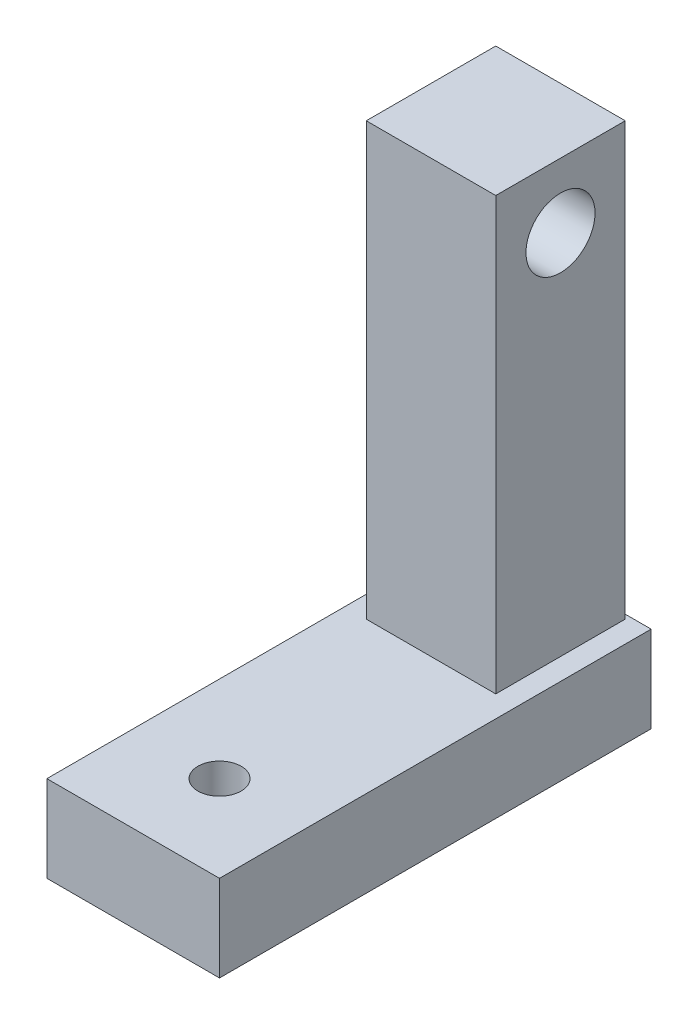
from build123d import *

# Parameters (mm, degrees)
ESQUISSE1_W             = 20
ESQUISSE1_H             = 50
ESQUISSE1_R             = 2.5
BOSS_EXTRU_1_DEPTH      = 10
ESQUISSE2_W             = 15
ESQUISSE2_H             = 15
BOSS_EXTRU_2_DEPTH      = 50
ESQUISSE3_R             = 4
ENL_V_MAT_EXTRU_1_DEPTH = 68.314560089


with BuildPart() as part:
    # Esquisse1 → Boss.-Extru.1 (new body)
    with BuildSketch(Plane(origin=(0, 0, 0), x_dir=(1, 0, 0), z_dir=(0, 1, 0))):
        Rectangle(ESQUISSE1_W, ESQUISSE1_H)
        with Locations(Location((0, -15, 0), (0, 0, 270))):
            Circle(ESQUISSE1_R, mode=Mode.SUBTRACT)
        with Locations(Location((0, 15, 0), (0, 0, 270))):
            Circle(ESQUISSE1_R, mode=Mode.SUBTRACT)
    extrude(amount=BOSS_EXTRU_1_DEPTH)


with BuildPart() as body_2:
    # Esquisse2 → Boss.-Extru.2 (new body)
    with BuildSketch(Plane(origin=(0, 10, 0), x_dir=(1, 0, 0), z_dir=(0, 1, 0))):
        with Locations((0, 17)):
            Rectangle(ESQUISSE2_W, ESQUISSE2_H)
    extrude(amount=BOSS_EXTRU_2_DEPTH)

    # Esquisse3 → Enlèv. mat.-Extru.1 (cut, through all)
    with BuildSketch(Plane(origin=(7.5, 0, 0), x_dir=(0, 0, -1), z_dir=(1, 0, 0))):
        with Locations((17, 52.5)):
            Circle(ESQUISSE3_R)
    extrude(amount=-ENL_V_MAT_EXTRU_1_DEPTH, mode=Mode.SUBTRACT)


solid = Compound([part.part, body_2.part])
